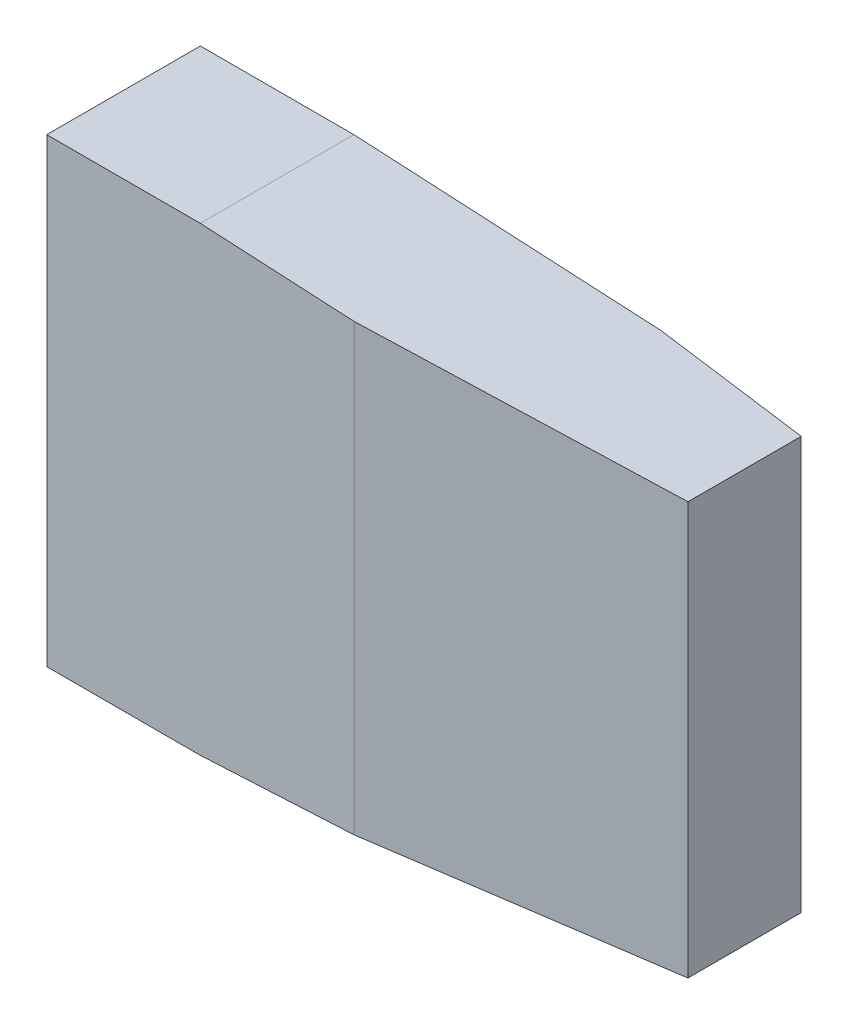
from build123d import *

# Parameters (mm, degrees)
SKETCH_1_W          = 200
SKETCH_1_H          = 50
EXTRUDE_1_DEPTH     = 75
CHAMFER_1_SIZE      = 100
CHAMFER_1_SIZE2     = 8.748866353
CHAMFER_2_SIZE      = 50
CHAMFER_2_SIZE2     = 4.374433176
CHAMFER_3_SIZE      = 150
CHAMFER_3_SIZE2     = 7.861166892
CHAMFER_4_SIZE      = 150
CHAMFER_4_SIZE2     = 7.861166892
SKETCH_2_R          = 8
CUT_EXTRUDE_1_DEPTH = 5


with BuildPart() as part:
    # 草图1 → 凸台-拉伸1 (new, symmetric)
    with BuildSketch(Plane(origin=(0, 0, 0), x_dir=(1, 0, 0), z_dir=(0, 1, 0))):
        Rectangle(SKETCH_1_W, SKETCH_1_H)
    extrude(amount=EXTRUDE_1_DEPTH, both=True)

    # 倒角1
    chamfer_1_edges = [part.edges().sort_by_distance(p)[0] for p in [
        (100, 0, 25),
    ]]
    chamfer_1_side = [part.faces().sort_by_distance(p)[0] for p in [
        (0, 0, 25),
    ]]
    chamfer(chamfer_1_edges, length=CHAMFER_1_SIZE, length2=CHAMFER_1_SIZE2, reference=chamfer_1_side[0])

    # 倒角2
    chamfer_2_edges = [part.edges().sort_by_distance(p)[0] for p in [
        (100, 0, -25),
    ]]
    chamfer_2_side = [part.faces().sort_by_distance(p)[0] for p in [
        (0, 0, -25),
    ]]
    chamfer(chamfer_2_edges, length=CHAMFER_2_SIZE, length2=CHAMFER_2_SIZE2, reference=chamfer_2_side[0])

    # 倒角3
    chamfer_3_edges = [part.edges().sort_by_distance(p)[0] for p in [
        (100, -75, -2.187216588),
    ]]
    chamfer_3_side = [part.faces().sort_by_distance(p)[0] for p in [
        (-4.049031765, -75, -0.749568205),
    ]]
    chamfer(chamfer_3_edges, length=CHAMFER_3_SIZE, length2=CHAMFER_3_SIZE2, reference=chamfer_3_side[0])

    # 倒角4
    chamfer_4_edges = [part.edges().sort_by_distance(p)[0] for p in [
        (100, 75, -2.187216588),
    ]]
    chamfer_4_side = [part.faces().sort_by_distance(p)[0] for p in [
        (-4.049031765, 75, -0.749568205),
    ]]
    chamfer(chamfer_4_edges, length=CHAMFER_4_SIZE, length2=CHAMFER_4_SIZE2, reference=chamfer_4_side[0])

    # 草图2 → 切除-拉伸1 (cut)
    with BuildSketch(Plane(origin=(0, 0, -25), x_dir=(-1, 0, 0), z_dir=(0, 0, -1))):
        with Locations((12, 0)):
            Circle(SKETCH_2_R)
    extrude(amount=-CUT_EXTRUDE_1_DEPTH, mode=Mode.SUBTRACT)


solid = part.part
